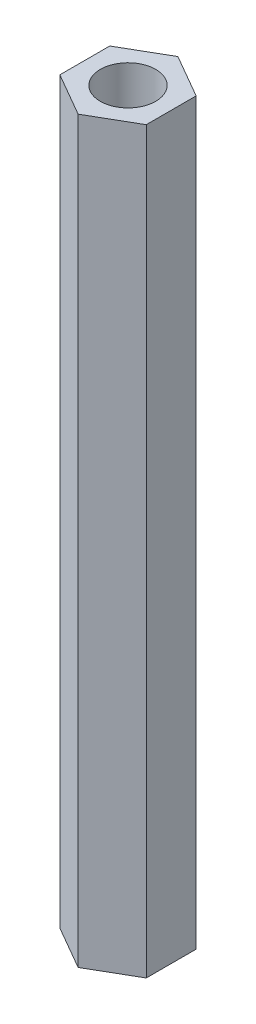
from build123d import *

# Parameters (mm, degrees)
SKETCH_1_R          = 2.7
SKETCH_1_R_2        = 1.5
EXTRUDE_1_DEPTH     = 40
CUT_EXTRUDE_START   = -40
CUT_EXTRUDE_1_DEPTH = 40


with BuildPart() as part:
    # 草图1 → 凸台-拉伸1 (new body)
    with BuildSketch(Plane(origin=(0, 0, 0), x_dir=(1, 0, 0), z_dir=(0, 1, 0))):
        with Locations(Location((0, 0, 0), (0, 0, 270))):
            Circle(SKETCH_1_R)
        with Locations(Location((0, 0, 0), (0, 0, 270))):
            Circle(SKETCH_1_R_2, mode=Mode.SUBTRACT)
    extrude(amount=EXTRUDE_1_DEPTH)

    # 草图2 → 切除-拉伸1 (cut)
    with BuildSketch(Plane(origin=(0, 40, 0), x_dir=(1, 0, 0), z_dir=(0, 1, 0)).offset(CUT_EXTRUDE_START)):
        with BuildLine():
            Line((-2.33826859, 1.35), (0, 2.7))
            ThreePointArc((0, 2.7), (-1.35, 2.33826859), (-2.33826859, 1.35))
        make_face()
        with BuildLine():
            Line((-2.33826859, -1.35), (-2.33826859, 1.35))
            ThreePointArc((-2.33826859, 1.35), (-2.7, 0), (-2.33826859, -1.35))
        make_face()
        with BuildLine():
            Line((0, -2.7), (-2.33826859, -1.35))
            ThreePointArc((-2.33826859, -1.35), (-1.35, -2.33826859), (0, -2.7))
        make_face()
        with BuildLine():
            ThreePointArc((0, -2.7), (1.35, -2.33826859), (2.33826859, -1.35))
            Line((2.33826859, -1.35), (0, -2.7))
        make_face()
        with BuildLine():
            ThreePointArc((2.7, 0), (2.607999731, 0.698811422), (2.33826859, 1.35))
            Line((2.33826859, 1.35), (2.33826859, -1.35))
            ThreePointArc((2.33826859, -1.35), (2.607999731, -0.698811422), (2.7, 0))
        make_face()
        with BuildLine():
            ThreePointArc((2.33826859, 1.35), (1.35, 2.33826859), (0, 2.7))
            Line((0, 2.7), (2.33826859, 1.35))
        make_face()
    extrude(amount=CUT_EXTRUDE_1_DEPTH, mode=Mode.SUBTRACT)


solid = part.part
